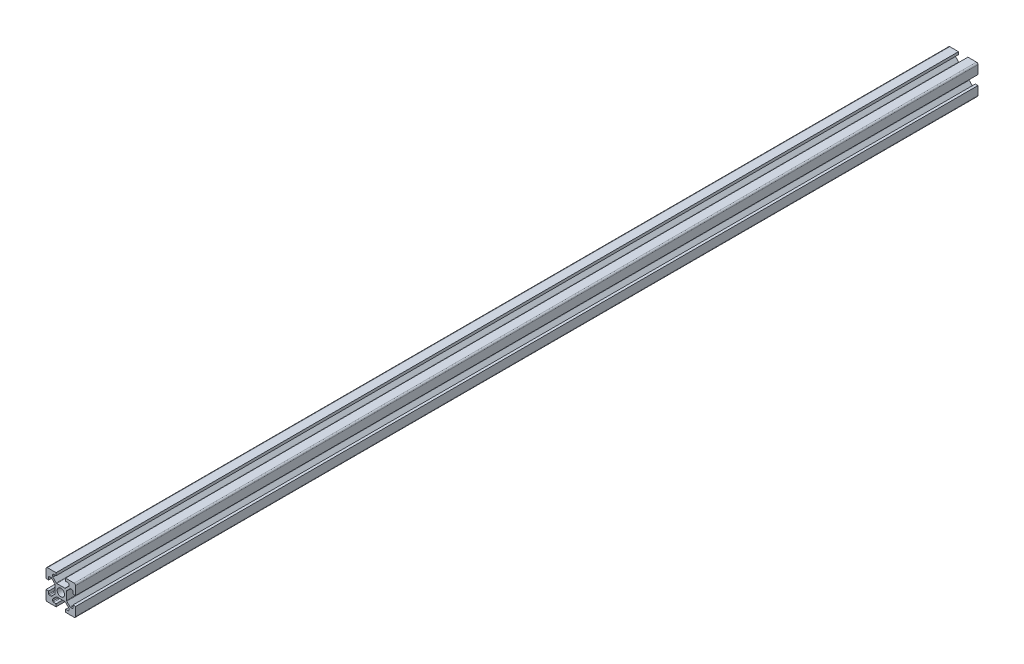
from build123d import *

# Parameters (mm, degrees)
SKETCH1_R           = 2.5
BOSS_EXTRUDE1_DEPTH = 609.6
FILLET1_R           = 1
FILLET2_R           = 0.5
FILLET3_R           = 0.5
FILLET4_R           = 0.5
FILLET5_R           = 0.5


with BuildPart() as part:
    # Sketch1 → Boss-Extrude1 (new body)
    with BuildSketch(Plane.XY):
        Polygon((13.2, 0), (13.2, 1.8), (15.45, 1.8), (15.45, 3.6), (12.95, 6.1), (7.05, 6.1), (4.55, 3.6), (4.55, 1.8), (6.8, 1.8), (6.8, 0), (0, 0), (0, 6.8), (1.8, 6.8), (1.8, 4.55), (3.6, 4.55), (6.1, 7.05), (6.1, 12.95), (3.6, 15.45), (1.8, 15.45), (1.8, 13.2), (0, 13.2), (0, 20), (6.8, 20), (6.8, 18.2), (4.55, 18.2), (4.55, 16.4), (7.05, 13.9), (12.95, 13.9), (15.45, 16.4), (15.45, 18.2), (13.2, 18.2), (13.2, 20), (20, 20), (20, 13.2), (18.2, 13.2), (18.2, 15.45), (16.4, 15.45), (13.9, 12.95), (13.9, 7.05), (16.4, 4.55), (18.2, 4.55), (18.2, 6.8), (20, 6.8), (20, 0), align=None)
        with Locations(Location((10, 10, 0), (0, 0, 180))):
            Circle(SKETCH1_R, mode=Mode.SUBTRACT)
    extrude(amount=BOSS_EXTRUDE1_DEPTH)

    # Fillet1
    fillet1_edges = [part.edges().sort_by_distance(p)[0] for p in [
        (0, 0, 304.8),
        (0, 20, 304.8),
        (20, 20, 304.8),
        (20, 0, 304.8),
    ]]
    fillet(fillet1_edges, radius=FILLET1_R)

    # Fillet2
    fillet2_edges = [part.edges().sort_by_distance(p)[0] for p in [
        (4.55, 18.2, 304.8),
        (4.55, 16.4, 304.8),
        (7.05, 13.9, 304.8),
        (12.95, 13.9, 304.8),
        (15.45, 16.4, 304.8),
        (15.45, 18.2, 304.8),
    ]]
    fillet(fillet2_edges, radius=FILLET2_R)

    # Fillet3
    fillet3_edges = [part.edges().sort_by_distance(p)[0] for p in [
        (18.2, 15.45, 304.8),
        (16.4, 15.45, 304.8),
        (13.9, 12.95, 304.8),
        (13.9, 7.05, 304.8),
        (16.4, 4.55, 304.8),
        (18.2, 4.55, 304.8),
    ]]
    fillet(fillet3_edges, radius=FILLET3_R)

    # Fillet4
    fillet4_edges = [part.edges().sort_by_distance(p)[0] for p in [
        (1.8, 4.55, 304.8),
        (3.6, 4.55, 304.8),
        (6.1, 7.05, 304.8),
        (6.1, 12.95, 304.8),
        (3.6, 15.45, 304.8),
        (1.8, 15.45, 304.8),
    ]]
    fillet(fillet4_edges, radius=FILLET4_R)

    # Fillet5
    fillet5_edges = [part.edges().sort_by_distance(p)[0] for p in [
        (15.45, 1.8, 304.8),
        (15.45, 3.6, 304.8),
        (12.95, 6.1, 304.8),
        (7.05, 6.1, 304.8),
        (4.55, 3.6, 304.8),
        (4.55, 1.8, 304.8),
    ]]
    fillet(fillet5_edges, radius=FILLET5_R)


solid = part.part
